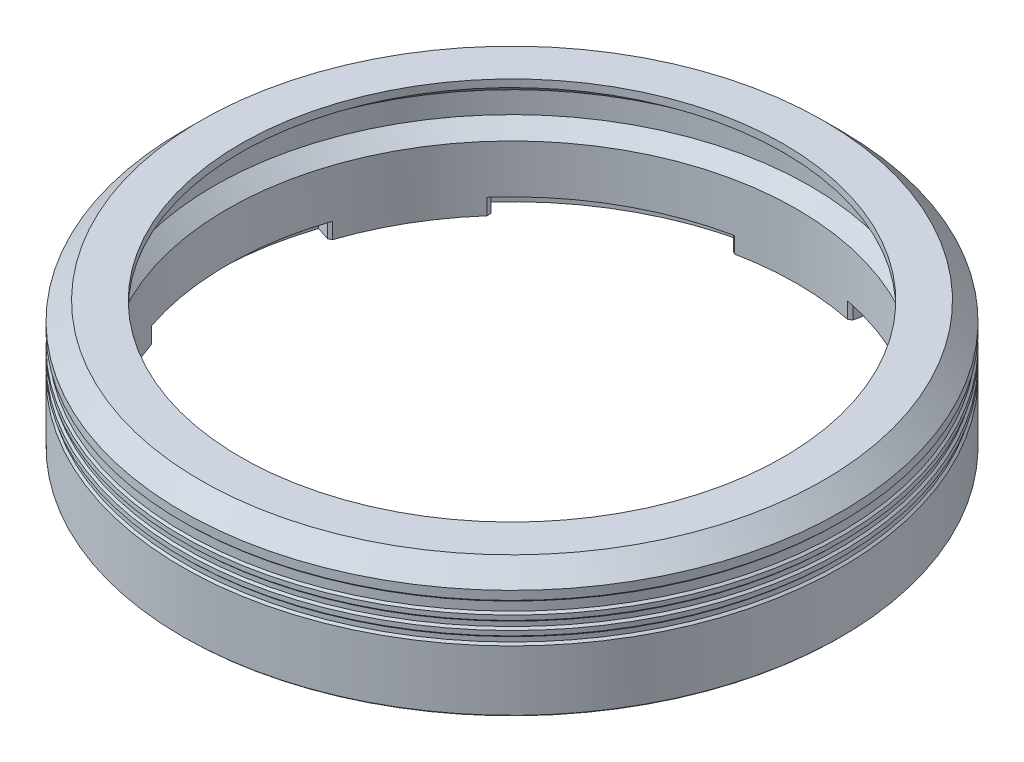
from build123d import *

# Parameters (mm, degrees)
SKETCH_2_R          = 1.55
CUT_EXTRUDE_1_DEPTH = 4
CUT_EXTRUDE_START   = -1.2
SKETCH_3_W          = 4
SKETCH_3_H          = 0.5
CUT_EXTRUDE_2_DEPTH = 1.2
CHAMFER_1_SIZE      = 0.2
CHAMFER_2_SIZE      = 0.1


with BuildPart() as part:
    # 草图1 → 旋转1 (revolve)
    with BuildSketch(Plane.XY, mode=Mode.PRIVATE) as revolve_1_sk:
        Polygon((-21.3, 0), (-21.3, 0.55), (-20.3, 0.55), (-20.3, 1.11), (-23.3, 1.11), (-24.65, -0.24), (-24.65, -0.89), (-24.5, -1.04), (-24.5, -1.69), (-24.65, -1.84), (-24.65, -2.19), (-24.5, -2.34), (-24.5, -2.69), (-24.65, -2.84), (-24.65, -3.19), (-24.5, -3.34), (-24.5, -3.69), (-24.65, -3.84), (-24.65, -8.435), (-21.3, -8.435), (-21.3, -3.615), (-22.3, -2.615), (-22.3, -1), align=None)
    revolve(revolve_1_sk.sketch.rotate(Axis((0, 0.266506915, 0), (0, 1, 0)), 270), axis=Axis((0, 0.266506915, 0), (0, 1, 0)))

    # 草图2 → 切除-拉伸1 (cut)
    with BuildSketch(Plane.XZ.offset(8.435)):
        with Locations(Location((19.875283017, 11.475, 0), (0, 0, 270))):
            Circle(SKETCH_2_R)
        with Locations(Location((19.875283017, -11.475, 0), (0, 0, 90))):
            Circle(SKETCH_2_R)
        with Locations(Location((-19.875283017, -11.475, 0), (0, 0, 270))):
            Circle(SKETCH_2_R)
        with Locations(Location((-19.875283017, 11.475, 0), (0, 0, 90))):
            Circle(SKETCH_2_R)
        with Locations(Location((0, 22.95, 0), (0, 0, 270))):
            Circle(SKETCH_2_R)
        with Locations(Location((0, -22.95, 0), (0, 0, 270))):
            Circle(SKETCH_2_R)
    extrude(amount=-CUT_EXTRUDE_1_DEPTH, mode=Mode.SUBTRACT)

    # 草图3 → 切除-拉伸2 (cut)
    with BuildSketch(Plane.XZ.offset(8.435).offset(CUT_EXTRUDE_START)):
        with BuildLine():
            Line((-16.757915815, 15.088895173), (-15.828984783, 14.252481915))
            ThreePointArc((-15.828984783, 14.252481915), (-10.65, 18.446341101), (-4.428519014, 20.834543896))
            Line((-4.428519014, 20.834543896), (-4.688408628, 22.057228397))
            ThreePointArc((-4.688408628, 22.057228397), (-11.275, 19.528872855), (-16.757915815, 15.088895173))
        make_face()
        with BuildLine():
            Line((4.688408628, 22.057228397), (4.428519014, 20.834543896))
            ThreePointArc((4.428519014, 20.834543896), (10.65, 18.446341101), (15.828984783, 14.252481915))
            Line((15.828984783, 14.252481915), (16.757915815, 15.088895173))
            ThreePointArc((16.757915815, 15.088895173), (11.275, 19.528872855), (4.688408628, 22.057228397))
        make_face()
        with BuildLine():
            Line((16.757915815, -15.088895173), (15.828984783, -14.252481915))
            ThreePointArc((15.828984783, -14.252481915), (10.65, -18.446341101), (4.428519014, -20.834543896))
            Line((4.428519014, -20.834543896), (4.688408628, -22.057228397))
            ThreePointArc((4.688408628, -22.057228397), (11.275, -19.528872855), (16.757915815, -15.088895173))
        make_face()
        with BuildLine():
            Line((21.446324442, 6.968333223), (20.257503797, 6.58206198))
            ThreePointArc((20.257503797, 6.58206198), (21.3, 0), (20.257503797, -6.58206198))
            Line((20.257503797, -6.58206198), (21.446324442, -6.968333223))
            ThreePointArc((21.446324442, -6.968333223), (22.55, 0), (21.446324442, 6.968333223))
        make_face()
        with BuildLine():
            Line((-21.446324442, -6.968333223), (-20.257503797, -6.58206198))
            ThreePointArc((-20.257503797, -6.58206198), (-21.3, 0), (-20.257503797, 6.58206198))
            Line((-20.257503797, 6.58206198), (-21.446324442, 6.968333223))
            ThreePointArc((-21.446324442, 6.968333223), (-22.55, 0), (-21.446324442, -6.968333223))
        make_face()
        with BuildLine():
            Line((-4.688408628, -22.057228397), (-4.428519014, -20.834543896))
            ThreePointArc((-4.428519014, -20.834543896), (-10.65, -18.446341101), (-15.828984783, -14.252481915))
            Line((-15.828984783, -14.252481915), (-16.757915815, -15.088895173))
            ThreePointArc((-16.757915815, -15.088895173), (-11.275, -19.528872855), (-4.688408628, -22.057228397))
        make_face()
        with Locations((0, -22.95)):
            Rectangle(SKETCH_3_W, SKETCH_3_H)
    extrude(amount=CUT_EXTRUDE_2_DEPTH, mode=Mode.SUBTRACT)

    # 倒角1
    chamfer_1_edges = [part.edges().sort_by_distance(p)[0] for p in [
        (-20.257503797, -7.835, 6.58206198),
        (-20.257503797, -7.835, -6.58206198),
        (20.257503797, -7.835, -6.58206198),
        (20.257503797, -7.835, 6.58206198),
        (4.428519014, -7.835, -20.834543896),
        (15.828984783, -7.835, -14.252481915),
        (15.828984783, -7.835, 14.252481915),
        (4.428519014, -7.835, 20.834543896),
        (-15.828984783, -7.835, -14.252481915),
        (-4.428519014, -7.835, -20.834543896),
        (-4.428519014, -7.835, 20.834543896),
        (-15.828984783, -7.835, 14.252481915),
    ]]
    chamfer(chamfer_1_edges, length=CHAMFER_1_SIZE)

    # 倒角2
    chamfer_2_edges = [part.edges().sort_by_distance(p)[0] for p in [
        (0, -8.435, 24.65),
    ]]
    chamfer(chamfer_2_edges, length=CHAMFER_2_SIZE)


solid = part.part
